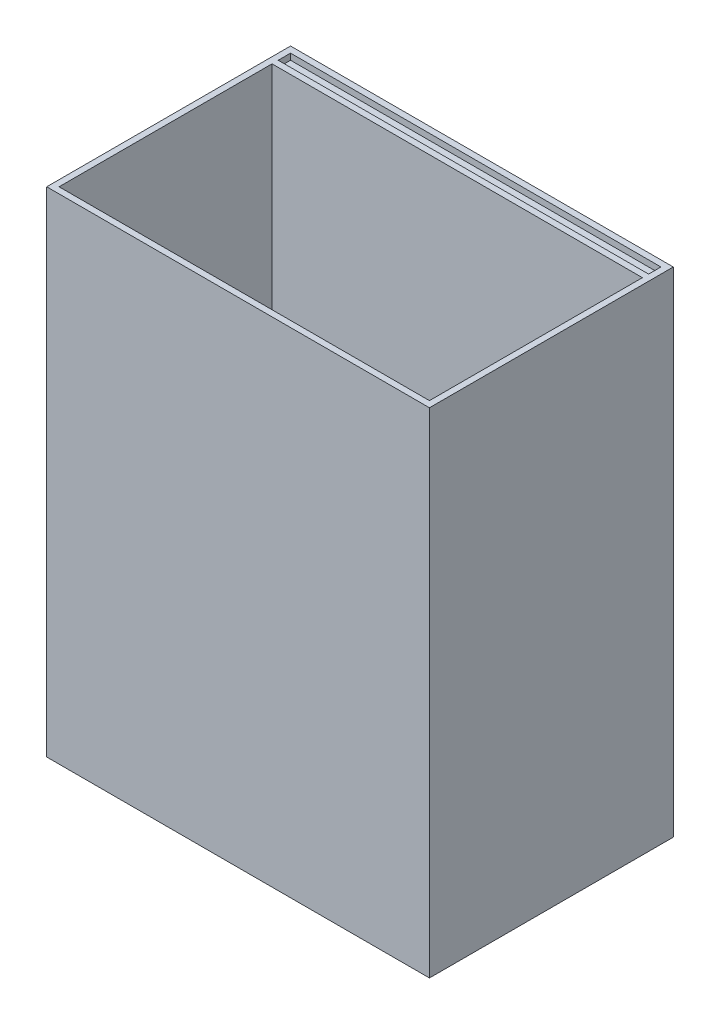
from build123d import *

# Parameters (mm, degrees)
SKETCH1_W            = 6200
SKETCH1_H            = 8000
BOSS_EXTRUDE1_DEPTH  = 100
SKETCH2_W            = 6200
SKETCH2_H            = 100
BOSS_EXTRUDE2_DEPTH  = 3850
SKETCH3_W            = 6200
SKETCH3_H            = 8000
BOSS_EXTRUDE3_DEPTH  = 100
SKETCH5_W            = 3750
SKETCH5_H            = 7900
BOSS_EXTRUDE4_DEPTH  = 100
SKETCH6_W            = 3750
SKETCH6_H            = 7900
BOSS_EXTRUDE5_DEPTH  = 100
SKETCH8_W            = 6100
SKETCH8_H            = 198.276900897
BOSS_EXTRUDE7_DEPTH  = 3550
SKETCH9_W            = 6000
SKETCH9_H            = 100
BOSS_EXTRUDE8_DEPTH  = 6400
SKETCH10_W           = 6200
SKETCH10_H           = 100
BOSS_EXTRUDE9_DEPTH  = 1500
SKETCH11_W           = 6200
SKETCH11_H           = 100
BOSS_EXTRUDE11_DEPTH = 300


with BuildPart() as part:
    # Sketch1 → Boss-Extrude1 (new body)
    with BuildSketch(Plane.XY):
        with Locations((3100, 4000)):
            Rectangle(SKETCH1_W, SKETCH1_H)
    extrude(amount=BOSS_EXTRUDE1_DEPTH)

    # Sketch2 → Boss-Extrude2 (add)
    with BuildSketch(Plane.XY.offset(100)):
        with Locations((3100, 50)):
            Rectangle(SKETCH2_W, SKETCH2_H)
    extrude(amount=BOSS_EXTRUDE2_DEPTH)

    # Sketch3 → Boss-Extrude3 (add)
    with BuildSketch(Plane.XY.offset(3950)):
        with Locations((3100, 4000)):
            Rectangle(SKETCH3_W, SKETCH3_H)
    extrude(amount=-BOSS_EXTRUDE3_DEPTH)

    # Sketch5 → Boss-Extrude4 (add)
    with BuildSketch(Plane(origin=(6200, 0, 0), x_dir=(0, 0, -1), z_dir=(1, 0, 0))):
        with Locations((-1975, 4050)):
            Rectangle(SKETCH5_W, SKETCH5_H)
    extrude(amount=-BOSS_EXTRUDE4_DEPTH)

    # Sketch6 → Boss-Extrude5 (add)
    with BuildSketch(Plane.ZY):
        with Locations((1975, 4050)):
            Rectangle(SKETCH6_W, SKETCH6_H)
    extrude(amount=-BOSS_EXTRUDE5_DEPTH)

    # Sketch8 → Boss-Extrude7 (add)
    with BuildSketch(Plane(origin=(0, 0, 3850), x_dir=(-1, 0, 0), z_dir=(0, 0, -1))):
        with Locations((-3050, 1500.861549552)):
            Rectangle(SKETCH8_W, SKETCH8_H)
    extrude(amount=BOSS_EXTRUDE7_DEPTH)

    # Sketch9 → Boss-Extrude8 (add)
    with BuildSketch(Plane(origin=(0, 1600, 0), x_dir=(1, 0, 0), z_dir=(0, 1, 0))):
        with Locations((3100, -350)):
            Rectangle(SKETCH9_W, SKETCH9_H)
    extrude(amount=BOSS_EXTRUDE8_DEPTH)

    # Sketch10 → Boss-Extrude9 (add)
    with BuildSketch(Plane.XZ):
        with Locations((3100, 3525)):
            Rectangle(SKETCH10_W, SKETCH10_H)
        with Locations((3100, 425)):
            Rectangle(SKETCH10_W, SKETCH10_H)
    extrude(amount=-BOSS_EXTRUDE9_DEPTH)

    # Sketch11 → Boss-Extrude11 (add)
    with BuildSketch(Plane(origin=(0, 0, 0), x_dir=(-1, 0, 0), z_dir=(0, 0, -1))):
        with Locations((-3100, 7850)):
            Rectangle(SKETCH11_W, SKETCH11_H)
        with Locations((-3100, 5750)):
            Rectangle(SKETCH11_W, SKETCH11_H)
        with Locations((-3100, 5150)):
            Rectangle(SKETCH11_W, SKETCH11_H)
    extrude(amount=-BOSS_EXTRUDE11_DEPTH)


solid = part.part
